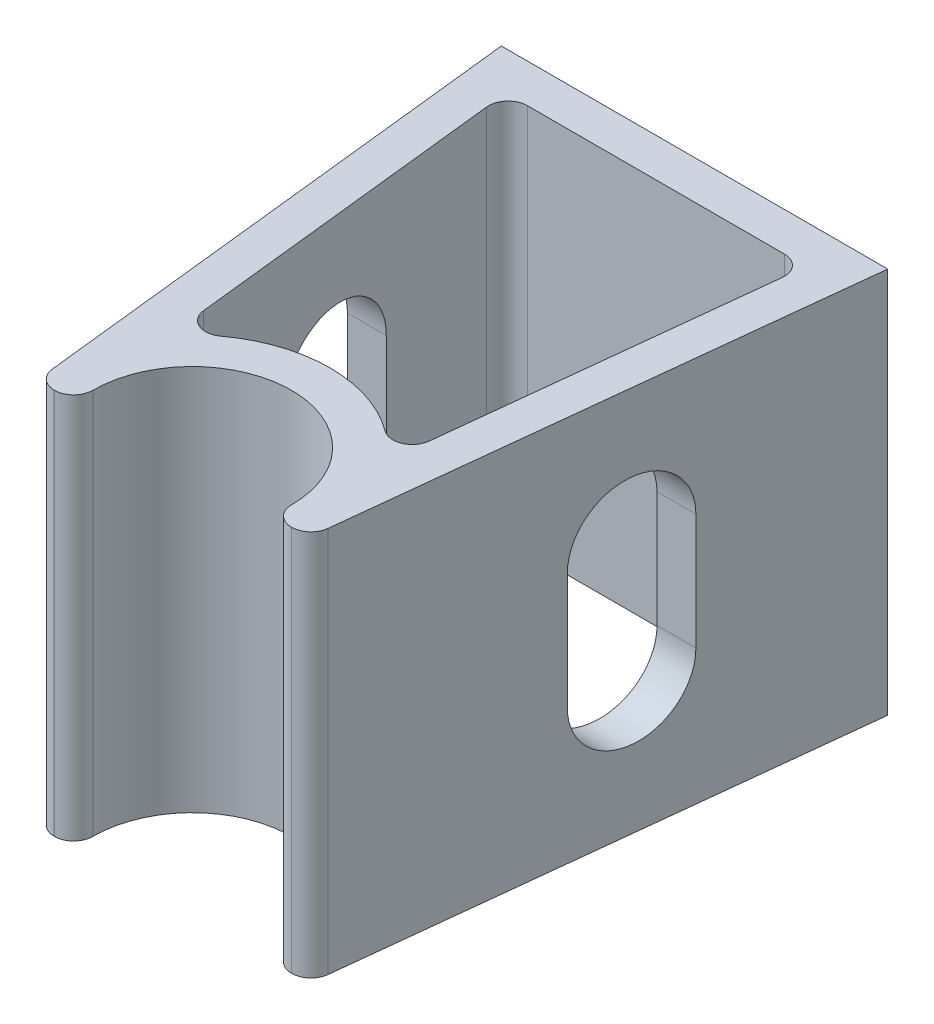
from build123d import *

# Parameters (mm, degrees)
BOSS_EXTRUDE1_DEPTH     = 50
CUT_EXTRUDE1_DEPTH      = 86.732140997
CUT_EXTRUDE1_DEPTH_BACK = 86.732140997
FILLET2_R               = 2.5
CUT_EXTRUDE2_DEPTH      = 86.732140997
CUT_EXTRUDE2_DEPTH_BACK = 86.732140997
SKETCH4_W               = 0.314102564
SKETCH4_H               = 2.557692308
SKETCH4_W_2             = 2.512820513
SKETCH4_H_2             = 0.224358974
BOSS_EXTRUDE2_DEPTH     = 1


with BuildPart() as part:
    # Sketch1 → Boss-Extrude1 (new body)
    with BuildSketch(Plane(origin=(0, 0, 0), x_dir=(1, 0, 0), z_dir=(0, 1, 0))):
        with BuildLine():
            Line((-12.6, -2.5), (-17.6, -2.5))
            Line((-17.6, -2.5), (-25, 65))
            Line((-25, 65), (25, 65))
            Line((25, 65), (17.6, -2.5))
            Line((17.6, -2.5), (12.6, -2.5))
            ThreePointArc((12.6, -2.5), (0, 12.845621822), (-12.6, -2.5))
        make_face()
    extrude(amount=BOSS_EXTRUDE1_DEPTH)

    # Sketch2 → Cut-Extrude1 (cut, two sides: drawn at the far end of the back side and taken through both)
    with BuildSketch(Plane(origin=(0, 50, 0), x_dir=(1, 0, 0), z_dir=(0, 1, 0)).offset(-CUT_EXTRUDE1_DEPTH_BACK)):
        with BuildLine():
            Line((14.050316299, 11.002491996), (19.421894954, 60))
            Line((19.421894954, 60), (-19.421894954, 60))
            Line((-19.421894954, 60), (-14.050316299, 11.002491996))
            ThreePointArc((-14.050316299, 11.002491996), (0, 17.845621822), (14.050316299, 11.002491996))
        make_face()
    extrude(amount=CUT_EXTRUDE1_DEPTH + CUT_EXTRUDE1_DEPTH_BACK, mode=Mode.SUBTRACT)

    # Fillet2
    fillet2_edges = [part.edges().sort_by_distance(p)[0] for p in [
        (-12.6, 25, 2.5),
        (-17.6, 25, 2.5),
        (17.6, 25, 2.5),
        (12.6, 25, 2.5),
        (14.050316299, 25, -11.002491996),
        (-14.050316299, 25, -11.002491996),
        (-19.421894954, 25, -60),
        (19.421894954, 25, -60),
    ]]
    fillet(fillet2_edges, radius=FILLET2_R)

    # Sketch3 → Cut-Extrude2 (cut, two sides: drawn at the far end of the back side and taken through both)
    with BuildSketch(Plane(origin=(0, 0, 0), x_dir=(0, 0, -1), z_dir=(1, 0, 0)).offset(-CUT_EXTRUDE2_DEPTH_BACK)):
        with BuildLine():
            Line((42.627558228, 32.5), (42.627558228, 17.5))
            ThreePointArc((42.627558228, 17.5), (35.127558228, 10), (27.627558228, 17.5))
            Line((27.627558228, 17.5), (27.627558228, 32.5))
            ThreePointArc((27.627558228, 32.5), (35.127558228, 40), (42.627558228, 32.5))
        make_face()
    extrude(amount=CUT_EXTRUDE2_DEPTH + CUT_EXTRUDE2_DEPTH_BACK, mode=Mode.SUBTRACT)

    # Sketch4 → Boss-Extrude2 (add)
    # profile 1 of 12: a face of its own
    with BuildSketch(Plane(origin=(0, 0, -65), x_dir=(-1, 0, 0), z_dir=(0, 0, -1))):
        with BuildLine():
            Line((-14.489153563, 26.614514951), (-14.175050999, 26.614514951))
            Line((-14.175050999, 26.614514951), (-14.175050999, 26.170003733))
            add(Edge.make_bspline(
                [(-14.175050999, 26.170003733), (-14.146767049, 26.208891335), (-14.09257229, 26.283403708), (-14.003706637, 26.381593992), (-13.914930525, 26.464922147), (-13.850997143, 26.508665018), (-13.820283371, 26.529679214)],
                knots=[0, 0, 0, 0, 1.134379233, 2.173579362, 3.122582517, 4, 4, 4, 4], degree=3))
            add(Edge.make_bspline(
                [(-13.820283371, 26.529679214), (-13.778418709, 26.549684579), (-13.695420809, 26.589345793), (-13.564001584, 26.629579351), (-13.429526915, 26.654304453), (-13.338718701, 26.657685826), (-13.293039781, 26.659386746)],
                knots=[0, 0, 0, 0, 1.014936303, 2.012140481, 3.000054389, 4, 4, 4, 4], degree=3))
            add(Edge.make_bspline(
                [(-13.293039781, 26.659386746), (-13.262146785, 26.658341455), (-13.201011206, 26.656272881), (-13.110427116, 26.642812846), (-13.022568504, 26.619546673), (-12.937954474, 26.587139349), (-12.858233795, 26.547892662), (-12.785144597, 26.501842954), (-12.719520389, 26.450145879), (-12.661394338, 26.390466946), (-12.609125313, 26.321130347), (-12.561046466, 26.240266098), (-12.516621254, 26.146058437), (-12.491999945, 26.077691896), (-12.479037377, 26.041698445)],
                knots=[0, 0, 0, 0, 1.009824226, 1.998387844, 2.986035974, 3.974953746, 4.955485308, 5.885931332, 6.793869504, 7.679848016, 8.601185859, 9.625726857, 10.749998409, 12, 12, 12, 12], degree=3))
            add(Edge.make_bspline(
                [(-12.479037377, 26.041698445), (-12.465326126, 26.066422864), (-12.438344309, 26.115077049), (-12.393038672, 26.183935311), (-12.345570875, 26.248342103), (-12.295536382, 26.308348527), (-12.243111796, 26.363658258), (-12.188050395, 26.414454159), (-12.130665614, 26.460954373), (-12.050873374, 26.515277533), (-11.947060767, 26.572978714), (-11.816172652, 26.623007158), (-11.68002248, 26.653923286), (-11.587604782, 26.657553559), (-11.540936416, 26.659386746)],
                knots=[0, 0, 0, 0, 0.86119277, 1.694706429, 2.50939023, 3.298075842, 4.073795165, 4.829715201, 5.57930267, 6.321991688, 7.768977793, 9.186738141, 10.579381044, 12, 12, 12, 12], degree=3))
            add(Edge.make_bspline(
                [(-11.540936416, 26.659386746), (-11.498054953, 26.657769525), (-11.414131767, 26.654604467), (-11.291954501, 26.629750994), (-11.178012696, 26.587073346), (-11.07253562, 26.52883971), (-10.977375806, 26.455660527), (-10.894659497, 26.368591689), (-10.824889134, 26.268249066), (-10.779310494, 26.173857077), (-10.74839523, 26.090521744), (-10.729333996, 26.019515453), (-10.7124943, 25.9413639), (-10.698513055, 25.855973639), (-10.688294503, 25.76304303), (-10.680723788, 25.662724154), (-10.675599714, 25.554939043), (-10.675237642, 25.480573543), (-10.675050999, 25.44223931)],
                knots=[0, 0, 0, 0, 1.209669288, 2.367440248, 3.500751976, 4.631527125, 5.755587489, 6.87532382, 8.007944318, 9.190864318, 9.82315674, 10.514484317, 11.263564316, 12.079023757, 12.955305781, 13.901327259, 14.918167583, 16, 16, 16, 16], degree=3))
            Line((-10.675050999, 25.44223931), (-10.675050999, 24.056822643))
            Line((-10.675050999, 24.056822643), (-10.989153563, 24.056822643))
            Line((-10.989153563, 24.056822643), (-10.989153563, 25.443641554))
            add(Edge.make_bspline(
                [(-10.989153563, 25.443641554), (-10.989231446, 25.476362128), (-10.989381126, 25.539246094), (-10.992074757, 25.629498546), (-10.997150071, 25.711766903), (-11.00308471, 25.785938991), (-11.011328519, 25.85218778), (-11.021974451, 25.910380198), (-11.033252131, 25.960974009), (-11.051988122, 26.017060057), (-11.081936014, 26.078930268), (-11.127553494, 26.145653843), (-11.1850236, 26.203734644), (-11.251383757, 26.25415296), (-11.326932201, 26.295146601), (-11.410196924, 26.324422611), (-11.500660976, 26.34254549), (-11.563283764, 26.344351505), (-11.595623916, 26.345284182)],
                knots=[0, 0, 0, 0, 1.253487763, 2.409012846, 3.458416907, 4.410876679, 5.259312806, 6.014470957, 6.676830364, 7.243083969, 8.276244668, 9.299465089, 10.325150304, 11.392391894, 12.482080715, 13.603491619, 14.762376348, 16, 16, 16, 16], degree=3))
            add(Edge.make_bspline(
                [(-11.595623916, 26.345284182), (-11.63529387, 26.343868024), (-11.713696781, 26.341069159), (-11.828142268, 26.312495286), (-11.938113284, 26.269415035), (-12.040328417, 26.206982578), (-12.134356208, 26.132174214), (-12.215255786, 26.043224619), (-12.282087971, 25.942594692), (-12.327341947, 25.849447989), (-12.355931248, 25.765778546), (-12.374808164, 25.692681174), (-12.389491556, 25.609599606), (-12.403262085, 25.517092115), (-12.412249813, 25.414521935), (-12.420418185, 25.302363534), (-12.424239048, 25.180279574), (-12.424773507, 25.095652886), (-12.425050999, 25.05171447)],
                knots=[0, 0, 0, 0, 1.090531906, 2.155305635, 3.229839962, 4.33261226, 5.44038871, 6.529323825, 7.629011124, 8.757537029, 9.370236727, 10.061839251, 10.834451254, 11.692844982, 12.636905849, 13.66920014, 14.789842145, 16, 16, 16, 16], degree=3))
            Line((-12.425050999, 25.05171447), (-12.425050999, 24.056822643))
            Line((-12.425050999, 24.056822643), (-12.739153563, 24.056822643))
            Line((-12.739153563, 24.056822643), (-12.739153563, 25.357403573))
            add(Edge.make_bspline(
                [(-12.739153563, 25.357403573), (-12.739232994, 25.394096892), (-12.739385812, 25.464691149), (-12.742062129, 25.565924824), (-12.747148751, 25.658005904), (-12.753029299, 25.740827368), (-12.761489477, 25.814238697), (-12.77109924, 25.878633455), (-12.78244785, 25.933850206), (-12.801237735, 25.994413591), (-12.829952203, 26.061134514), (-12.876140465, 26.132275535), (-12.933748045, 26.194543632), (-13.001318921, 26.247702381), (-13.077324603, 26.291643862), (-13.161308004, 26.323303614), (-13.252512917, 26.341727904), (-13.315390623, 26.3440764), (-13.347727281, 26.345284182)],
                knots=[0, 0, 0, 0, 1.320475261, 2.540461679, 3.643808994, 4.639130445, 5.527981419, 6.302341397, 6.981980563, 7.553956391, 8.582137848, 9.585246428, 10.591171744, 11.620968678, 12.668337649, 13.738356861, 14.836885341, 16, 16, 16, 16], degree=3))
            add(Edge.make_bspline(
                [(-13.347727281, 26.345284182), (-13.385743493, 26.343753722), (-13.461508452, 26.340703569), (-13.572810422, 26.313249296), (-13.680296105, 26.270245221), (-13.782250804, 26.210585402), (-13.875924953, 26.136686323), (-13.95793322, 26.049771427), (-14.026875745, 25.950922394), (-14.07260756, 25.858757877), (-14.102106034, 25.777184602), (-14.121701369, 25.707833655), (-14.138540995, 25.630833406), (-14.151055017, 25.545946295), (-14.163135432, 25.453725201), (-14.168965741, 25.353710712), (-14.174637303, 25.245988624), (-14.174909718, 25.171616079), (-14.175050999, 25.133044599)],
                knots=[0, 0, 0, 0, 1.098833095, 2.189935336, 3.297829714, 4.440610912, 5.596351641, 6.740013378, 7.886572111, 9.072425424, 9.705826452, 10.395263256, 11.156850408, 11.985370555, 12.878090359, 13.847760091, 14.883794034, 16, 16, 16, 16], degree=3))
            Line((-14.175050999, 25.133044599), (-14.175050999, 24.056822643))
            Line((-14.175050999, 24.056822643), (-14.489153563, 24.056822643))
            Line((-14.489153563, 24.056822643), (-14.489153563, 26.614514951))
        make_face()
    # profile 2 of 12: a face of its own
    with BuildSketch(Plane(origin=(0, 0, -65), x_dir=(-1, 0, 0), z_dir=(0, 0, -1))):
        with BuildLine():
            Line((-7.354538179, 26.614514951), (-7.354538179, 24.056822643))
            Line((-7.354538179, 24.056822643), (-7.668640743, 24.056822643))
            Line((-7.668640743, 24.056822643), (-7.668640743, 24.499230496))
            add(Edge.make_bspline(
                [(-7.668640743, 24.499230496), (-7.704059533, 24.459190902), (-7.773179749, 24.381053131), (-7.888620867, 24.278970958), (-8.010989045, 24.194592637), (-8.139690366, 24.126442721), (-8.274608609, 24.075250665), (-8.415444696, 24.038864506), (-8.562256077, 24.015470671), (-8.662508432, 24.013134649), (-8.713312217, 24.011950849)],
                knots=[0, 0, 0, 0, 1.074387032, 2.096679803, 3.090159297, 4.057316773, 5.018401886, 5.985159533, 6.978961417, 8, 8, 8, 8], degree=3))
            add(Edge.make_bspline(
                [(-8.713312217, 24.011950849), (-8.758480171, 24.013177221), (-8.847553376, 24.015595681), (-8.978582453, 24.034357985), (-9.104674703, 24.064488606), (-9.225949275, 24.106389496), (-9.341621421, 24.161970318), (-9.452681517, 24.228511566), (-9.558554209, 24.307752396), (-9.657625748, 24.398340424), (-9.748857749, 24.496735411), (-9.828919021, 24.601680958), (-9.895672101, 24.712723262), (-9.951492182, 24.828456416), (-9.994488526, 24.949771335), (-10.024462161, 25.076248503), (-10.043202607, 25.207738377), (-10.045620068, 25.2972779), (-10.046845871, 25.342680015)],
                knots=[0, 0, 0, 0, 1.033919861, 2.038935746, 3.024066025, 3.998881131, 4.97069526, 5.957263378, 6.95902576, 7.993208707, 9.027059324, 10.027763471, 11.009749337, 11.988697705, 12.965288445, 13.950418724, 14.960734635, 16, 16, 16, 16], degree=3))
            add(Edge.make_bspline(
                [(-10.046845871, 25.342680015), (-10.0455929, 25.387143719), (-10.043115843, 25.475046062), (-10.024662623, 25.60432476), (-9.993631614, 25.728843021), (-9.950083767, 25.848199964), (-9.894241812, 25.962540014), (-9.826313725, 26.071944039), (-9.7462946, 26.176713437), (-9.654042193, 26.274384663), (-9.554107423, 26.364605278), (-9.447198692, 26.443014323), (-9.335975411, 26.510731172), (-9.2187124, 26.564384648), (-9.097145295, 26.607793753), (-8.970191849, 26.637826721), (-8.838380271, 26.655524042), (-8.748889779, 26.658086806), (-8.703496512, 26.659386746)],
                knots=[0, 0, 0, 0, 1.020392517, 2.01726096, 2.990465484, 3.961182959, 4.928053699, 5.906110375, 6.912531644, 7.948652711, 8.985773172, 9.998621852, 10.987621588, 11.969261332, 12.953316658, 13.946091881, 14.958173133, 16, 16, 16, 16], degree=3))
            add(Edge.make_bspline(
                [(-8.703496512, 26.659386746), (-8.651296653, 26.657948994), (-8.548935193, 26.655129632), (-8.399207184, 26.631666904), (-8.257562706, 26.592028437), (-8.122908354, 26.538110939), (-7.995727668, 26.46646221), (-7.877224683, 26.376082249), (-7.7661592, 26.267541062), (-7.701778908, 26.184170617), (-7.668640743, 26.14125774)],
                knots=[0, 0, 0, 0, 1.038897134, 2.037228247, 3.008116434, 3.962042015, 4.918381754, 5.904844433, 6.921570401, 8, 8, 8, 8], degree=3))
            Line((-7.668640743, 26.14125774), (-7.668640743, 26.614514951))
            Line((-7.668640743, 26.614514951), (-7.354538179, 26.614514951))
        make_face()
        with BuildLine():
            add(Edge.make_bspline(
                [(-8.699289781, 26.345284182), (-8.745204119, 26.343650544), (-8.835831719, 26.340426003), (-8.968875721, 26.315252508), (-9.096189135, 26.273367914), (-9.21713521, 26.216086012), (-9.329803426, 26.144057276), (-9.430497097, 26.056935892), (-9.520039798, 25.957098878), (-9.595348063, 25.844996768), (-9.65673856, 25.724818677), (-9.699905591, 25.599194239), (-9.728374839, 25.470389261), (-9.731283359, 25.383026575), (-9.732743307, 25.339174406)],
                knots=[0, 0, 0, 0, 1.031046209, 2.035121221, 3.029706178, 4.034933723, 5.034054252, 6.02443088, 7.017295772, 8.038157696, 9.050218397, 10.03989886, 11.016116709, 12, 12, 12, 12], degree=3))
            add(Edge.make_bspline(
                [(-9.732743307, 25.339174406), (-9.730878414, 25.295584299), (-9.727155937, 25.208574943), (-9.700405242, 25.079594366), (-9.655525369, 24.953940324), (-9.594283306, 24.832679331), (-9.517596681, 24.72009523), (-9.428708029, 24.618355108), (-9.326757748, 24.53086552), (-9.213830241, 24.457627946), (-9.09322227, 24.398465425), (-8.966388339, 24.357299786), (-8.835712701, 24.330722005), (-8.746860367, 24.327617528), (-8.702094268, 24.326053413)],
                knots=[0, 0, 0, 0, 0.979072187, 1.954306742, 2.945804271, 3.96968567, 4.997920485, 5.998718438, 6.996577872, 8.005894225, 9.015743152, 10.005417472, 10.995077863, 12, 12, 12, 12], degree=3))
            add(Edge.make_bspline(
                [(-8.702094268, 24.326053413), (-8.656647766, 24.327713377), (-8.566259179, 24.33101488), (-8.432820471, 24.356296145), (-8.303325509, 24.398064944), (-8.17953828, 24.455964071), (-8.064222149, 24.527721426), (-7.960724271, 24.611728517), (-7.873208303, 24.709431702), (-7.799015693, 24.816808155), (-7.740840277, 24.934520151), (-7.698464218, 25.059854342), (-7.673410312, 25.19281509), (-7.670252582, 25.283679017), (-7.668640743, 25.330059823)],
                knots=[0, 0, 0, 0, 1.01762866, 2.023962475, 3.030623092, 4.058876274, 5.077231937, 6.066672613, 7.034107872, 8.005628644, 8.981990164, 9.965428785, 10.961468474, 12, 12, 12, 12], degree=3))
            add(Edge.make_bspline(
                [(-7.668640743, 25.330059823), (-7.669600399, 25.365397653), (-7.671489307, 25.434953687), (-7.685919876, 25.537081204), (-7.708874803, 25.63481493), (-7.741220973, 25.728257619), (-7.783712257, 25.816892635), (-7.834960023, 25.901356395), (-7.895865473, 25.981209606), (-7.965448169, 26.055352677), (-8.041613371, 26.12297914), (-8.122207912, 26.18334338), (-8.208186659, 26.232932153), (-8.298103696, 26.273973425), (-8.39211503, 26.306632574), (-8.49098565, 26.328420268), (-8.593664637, 26.343380589), (-8.663710692, 26.34464297), (-8.699289781, 26.345284182)],
                knots=[0, 0, 0, 0, 1.050140795, 2.067009409, 3.05949893, 4.030605086, 5.00011959, 5.97591094, 6.962425594, 7.979863591, 8.993523472, 9.986985069, 10.967611495, 11.937549037, 12.921786183, 13.919465291, 14.943216303, 16, 16, 16, 16], degree=3))
        make_face(mode=Mode.SUBTRACT)
    # profile 3 of 12: a face of its own
    with BuildSketch(Plane(origin=(0, 0, -65), x_dir=(-1, 0, 0), z_dir=(0, 0, -1))):
        with BuildLine():
            add(Edge.make_bspline(
                [(-6.525812217, 27.691438028), (-6.506320901, 27.690533876), (-6.468153162, 27.688763372), (-6.412959894, 27.673601894), (-6.362702882, 27.647902209), (-6.318125149, 27.613422528), (-6.279873262, 27.572873085), (-6.253092552, 27.525612116), (-6.235880156, 27.474553478), (-6.2338016, 27.438938388), (-6.232743307, 27.420805015)],
                knots=[0, 0, 0, 0, 1.055194115, 2.066272739, 3.074728998, 4.095836921, 5.109056067, 6.073838105, 7.019297344, 8, 8, 8, 8], degree=3))
            add(Edge.make_bspline(
                [(-6.232743307, 27.420805015), (-6.233825467, 27.403142362), (-6.235964769, 27.368225387), (-6.253079257, 27.318051915), (-6.280101495, 27.271447631), (-6.31810062, 27.230976921), (-6.362709381, 27.196516301), (-6.412958167, 27.170811562), (-6.468153616, 27.155651425), (-6.506321055, 27.153880736), (-6.525812217, 27.15297649)],
                knots=[0, 0, 0, 0, 0.96129708, 1.900370562, 2.859976407, 3.87933698, 4.906634145, 5.921202961, 6.938410037, 8, 8, 8, 8], degree=3))
            add(Edge.make_bspline(
                [(-6.525812217, 27.15297649), (-6.545080492, 27.15384621), (-6.582583673, 27.155539007), (-6.636950515, 27.171109024), (-6.686779004, 27.196525097), (-6.731443677, 27.230751282), (-6.76867387, 27.27169618), (-6.795772195, 27.318023474), (-6.812847157, 27.368232628), (-6.814991786, 27.403144794), (-6.81607664, 27.420805015)],
                knots=[0, 0, 0, 0, 1.054934014, 2.053291228, 3.073705704, 4.106921865, 5.123545215, 6.088680038, 7.033164197, 8, 8, 8, 8], degree=3))
            add(Edge.make_bspline(
                [(-6.81607664, 27.420805015), (-6.815015554, 27.438935865), (-6.812931513, 27.474545997), (-6.795759396, 27.52564103), (-6.768899589, 27.572622532), (-6.731419025, 27.613648032), (-6.686785565, 27.647893466), (-6.63694882, 27.673304448), (-6.58258412, 27.688875787), (-6.545080644, 27.690568402), (-6.525812217, 27.691438028)],
                knots=[0, 0, 0, 0, 0.98631895, 1.937192651, 2.907499808, 3.917963147, 4.944918757, 5.95915025, 6.951458133, 8, 8, 8, 8], degree=3))
        make_face()
    # profile 4 of 12: a face of its own
    with BuildSketch(Plane(origin=(0, 0, -65), x_dir=(-1, 0, 0), z_dir=(0, 0, -1))):
        with Locations((-6.524409974, 25.335668797)):
            Rectangle(SKETCH4_W, SKETCH4_H)
    # profile 5 of 12: a face of its own
    with BuildSketch(Plane(origin=(0, 0, -65), x_dir=(-1, 0, 0), z_dir=(0, 0, -1))):
        with BuildLine():
            Line((-5.604538179, 26.614514951), (-5.290435615, 26.614514951))
            Line((-5.290435615, 26.614514951), (-5.290435615, 26.15317681))
            add(Edge.make_bspline(
                [(-5.290435615, 26.15317681), (-5.25689798, 26.195019533), (-5.191817028, 26.276216796), (-5.083432695, 26.382937371), (-4.968888795, 26.470882596), (-4.848886791, 26.54098639), (-4.723263781, 26.593833016), (-4.592785511, 26.631998947), (-4.456670805, 26.654883776), (-4.364106368, 26.657874006), (-4.317278563, 26.659386746)],
                knots=[0, 0, 0, 0, 1.12780773, 2.188550248, 3.19190651, 4.159438251, 5.104880172, 6.052711206, 7.014878035, 8, 8, 8, 8], degree=3))
            add(Edge.make_bspline(
                [(-4.317278563, 26.659386746), (-4.269947929, 26.657641551), (-4.177310461, 26.654225782), (-4.0424324, 26.627209091), (-3.916459006, 26.581063836), (-3.799839451, 26.517851765), (-3.694712237, 26.439245292), (-3.602387386, 26.34766751), (-3.526024138, 26.242331427), (-3.474826775, 26.144608271), (-3.441101128, 26.057919477), (-3.41986879, 25.983672726), (-3.401837809, 25.900954575), (-3.386206061, 25.810014986), (-3.375628949, 25.710216796), (-3.367286657, 25.601969104), (-3.361307963, 25.485306973), (-3.361070756, 25.404620346), (-3.360948435, 25.363012547)],
                knots=[0, 0, 0, 0, 1.235846778, 2.418850247, 3.575807741, 4.728682307, 5.871620074, 6.994088408, 8.11269785, 9.256955736, 9.865816715, 10.540099792, 11.271859618, 12.076849838, 12.949306005, 13.892391288, 14.913166135, 16, 16, 16, 16], degree=3))
            Line((-3.360948435, 25.363012547), (-3.360948435, 24.056822643))
            Line((-3.360948435, 24.056822643), (-3.675050999, 24.056822643))
            Line((-3.675050999, 24.056822643), (-3.675050999, 25.259947643))
            add(Edge.make_bspline(
                [(-3.675050999, 25.259947643), (-3.675244207, 25.294770088), (-3.675613781, 25.361379499), (-3.676779428, 25.456748522), (-3.679589235, 25.543235101), (-3.683537548, 25.620632468), (-3.689316578, 25.688866305), (-3.695339209, 25.748075581), (-3.702704186, 25.798185124), (-3.709267099, 25.828350206), (-3.712210454, 25.841878733)],
                knots=[0, 0, 0, 0, 1.430800155, 2.736877192, 3.918605307, 4.986035426, 5.920637409, 6.731861385, 7.431261377, 8, 8, 8, 8], degree=3))
            add(Edge.make_bspline(
                [(-3.712210454, 25.841878733), (-3.722835986, 25.881589918), (-3.743286847, 25.958021663), (-3.79382083, 26.061696015), (-3.85763501, 26.149894203), (-3.93553286, 26.222070925), (-4.026761935, 26.278241761), (-4.131069078, 26.317215716), (-4.247447719, 26.341591985), (-4.329302102, 26.344019117), (-4.371966063, 26.345284182)],
                knots=[0, 0, 0, 0, 1.084156227, 2.086665306, 3.027808233, 3.945421172, 4.874247719, 5.839848303, 6.874090471, 8, 8, 8, 8], degree=3))
            add(Edge.make_bspline(
                [(-4.371966063, 26.345284182), (-4.397233747, 26.344808177), (-4.44723784, 26.343866176), (-4.521387812, 26.334414878), (-4.593311985, 26.318956423), (-4.663732194, 26.298087785), (-4.731239988, 26.269425516), (-4.798004279, 26.236896146), (-4.861511043, 26.196347934), (-4.92311444, 26.151157312), (-4.980427248, 26.101078105), (-5.033755586, 26.048233595), (-5.081293607, 25.991957991), (-5.124362282, 25.933158044), (-5.161540545, 25.871026206), (-5.193993633, 25.806161899), (-5.221529328, 25.73847975), (-5.235212021, 25.691504689), (-5.242058211, 25.668000528)],
                knots=[0, 0, 0, 0, 1.023777757, 2.026029729, 3.023749952, 4.003683103, 4.997618607, 5.993177895, 7.010360494, 8.046726602, 9.087585522, 10.09234134, 11.086953743, 12.070360549, 13.043493632, 14.017870808, 15.008233677, 16, 16, 16, 16], degree=3))
            add(Edge.make_bspline(
                [(-5.242058211, 25.668000528), (-5.245997859, 25.650745325), (-5.254574268, 25.613181651), (-5.263837448, 25.551537231), (-5.272245023, 25.480227256), (-5.279281982, 25.399334939), (-5.283587399, 25.308577064), (-5.288281795, 25.208341226), (-5.289990856, 25.098227738), (-5.29028321, 25.021566045), (-5.290435615, 24.981602291)],
                knots=[0, 0, 0, 0, 0.615963638, 1.340920617, 2.168419149, 3.115676021, 4.16674242, 5.331190069, 6.6087489, 8, 8, 8, 8], degree=3))
            Line((-5.290435615, 24.981602291), (-5.290435615, 24.056822643))
            Line((-5.290435615, 24.056822643), (-5.604538179, 24.056822643))
            Line((-5.604538179, 24.056822643), (-5.604538179, 26.614514951))
        make_face()
    # profile 6 of 12: a face of its own
    with BuildSketch(Plane(origin=(0, 0, -65), x_dir=(-1, 0, 0), z_dir=(0, 0, -1))):
        with Locations((-1.790435615, 23.585668797)):
            Rectangle(SKETCH4_W_2, SKETCH4_H_2)
    # profile 7 of 12: a face of its own
    with BuildSketch(Plane(origin=(0, 0, -65), x_dir=(-1, 0, 0), z_dir=(0, 0, -1))):
        with BuildLine():
            Line((-0.219922794, 24.056822643), (-0.219922794, 27.646566233))
            Line((-0.219922794, 27.646566233), (0.09417977, 27.646566233))
            Line((0.09417977, 27.646566233), (0.09417977, 26.150372323))
            add(Edge.make_bspline(
                [(0.09417977, 26.150372323), (0.129573189, 26.191130255), (0.198627208, 26.27065066), (0.31440366, 26.37449831), (0.435809229, 26.462550787), (0.563767485, 26.535136906), (0.698460418, 26.590410513), (0.839192527, 26.630832903), (0.986323568, 26.655219806), (1.086642742, 26.657985879), (1.137449001, 26.659386746)],
                knots=[0, 0, 0, 0, 1.077089805, 2.101446609, 3.097517232, 4.067117542, 5.031729543, 5.997785507, 6.985986182, 8, 8, 8, 8], degree=3))
            add(Edge.make_bspline(
                [(1.137449001, 26.659386746), (1.182615139, 26.658146518), (1.27191629, 26.655694375), (1.403198438, 26.63705988), (1.529511713, 26.606842078), (1.650787361, 26.564949899), (1.766459493, 26.509366921), (1.87751855, 26.442825614), (1.983395535, 26.363587284), (2.08245042, 26.272988974), (2.173744306, 26.174632351), (2.253656817, 26.069452036), (2.321156513, 25.958976945), (2.376987805, 25.843576883), (2.420158858, 25.722780532), (2.449901125, 25.596706333), (2.46879459, 25.465478315), (2.471174836, 25.376165511), (2.472384898, 25.330760945)],
                knots=[0, 0, 0, 0, 1.034377878, 2.045141349, 3.03070803, 4.00595497, 4.978199603, 5.965204761, 6.967410914, 8.002051993, 9.036360596, 10.037508045, 11.022711142, 11.997267194, 12.969246472, 13.954813154, 14.960274251, 16, 16, 16, 16], degree=3))
            add(Edge.make_bspline(
                [(2.472384898, 25.330760945), (2.471148458, 25.286060927), (2.468710392, 25.197919532), (2.450089084, 25.068212975), (2.419342819, 24.943374276), (2.375381636, 24.823726019), (2.320116697, 24.708706106), (2.251005421, 24.599625702), (2.171194422, 24.494586726), (2.078863273, 24.396963094), (1.97894972, 24.306729694), (1.872035477, 24.228323829), (1.760813556, 24.160606709), (1.643550444, 24.106951262), (1.521982402, 24.06355034), (1.394807015, 24.033432649), (1.262743787, 24.015859594), (1.173024899, 24.013264027), (1.127633296, 24.011950849)],
                knots=[0, 0, 0, 0, 1.024244038, 2.01964794, 2.996620209, 3.965911562, 4.936179293, 5.91563013, 6.920572822, 7.955171681, 8.990768464, 10.002129126, 10.989675881, 11.969873457, 12.952483066, 13.943799762, 14.959703725, 16, 16, 16, 16], degree=3))
            add(Edge.make_bspline(
                [(1.127633296, 24.011950849), (1.075668183, 24.013391457), (0.973773659, 24.016216238), (0.824720994, 24.039635218), (0.683639444, 24.079496828), (0.548921896, 24.133058583), (0.422494173, 24.205587238), (0.30355359, 24.295543988), (0.192850218, 24.404411124), (0.127633402, 24.487472614), (0.09417977, 24.530079855)],
                knots=[0, 0, 0, 0, 1.035807596, 2.031038093, 2.998900396, 3.954262848, 4.914341711, 5.895762244, 6.92060972, 8, 8, 8, 8], degree=3))
            Line((0.09417977, 24.530079855), (0.09417977, 24.056822643))
            Line((0.09417977, 24.056822643), (-0.219922794, 24.056822643))
        make_face()
        with BuildLine():
            add(Edge.make_bspline(
                [(1.124828808, 24.326053413), (1.170743161, 24.327687042), (1.26137079, 24.330911565), (1.39441458, 24.356085188), (1.52172879, 24.397969302), (1.642671872, 24.45525301), (1.755351184, 24.527275045), (1.856003818, 24.614421216), (1.945483527, 24.71392273), (2.020135303, 24.826156424), (2.082461548, 24.945607393), (2.125274824, 25.071261694), (2.153994545, 25.199756483), (2.156846844, 25.286902528), (2.158282334, 25.330760945)],
                knots=[0, 0, 0, 0, 1.031910345, 2.036826888, 3.032245421, 4.038315463, 5.03827337, 6.029480047, 7.023177075, 8.037597977, 9.052889626, 10.043399556, 11.015292101, 12, 12, 12, 12], degree=3))
            add(Edge.make_bspline(
                [(2.158282334, 25.330760945), (2.15639459, 25.374576487), (2.152626639, 25.462032647), (2.126251856, 25.591682315), (2.080194066, 25.717269939), (2.019076043, 25.838447928), (1.943208058, 25.951455728), (1.854202094, 26.052945855), (1.752320288, 26.14050584), (1.639496869, 26.213495911), (1.519316678, 26.273055464), (1.392826044, 26.313900489), (1.262667922, 26.340638677), (1.174272429, 26.343727805), (1.129736661, 26.345284182)],
                knots=[0, 0, 0, 0, 0.984795267, 1.965658976, 2.959410029, 3.983795688, 5.009594896, 6.01088574, 7.009236619, 8.019050059, 9.024672985, 10.014834719, 10.999826153, 12, 12, 12, 12], degree=3))
            add(Edge.make_bspline(
                [(1.129736661, 26.345284182), (1.084269154, 26.343728684), (0.994025377, 26.340641338), (0.860857155, 26.313853514), (0.730793871, 26.272805902), (0.606506339, 26.213874553), (0.490652284, 26.141763092), (0.387039671, 26.057022893), (0.297708114, 25.960242985), (0.224164343, 25.851737183), (0.165759544, 25.734552147), (0.123975796, 25.609539944), (0.098976149, 25.477358632), (0.095798017, 25.386725426), (0.09417977, 25.34057665)],
                knots=[0, 0, 0, 0, 1.016820015, 2.018181405, 3.029022337, 4.06341356, 5.088169224, 6.076823655, 7.05054209, 8.02560866, 9.001194327, 9.972267242, 10.967515442, 12, 12, 12, 12], degree=3))
            add(Edge.make_bspline(
                [(0.09417977, 25.34057665), (0.09513944, 25.305238831), (0.097028375, 25.235682822), (0.111458744, 25.133555131), (0.134414406, 25.035822039), (0.1667579, 24.942377043), (0.209259135, 24.853750604), (0.2604694, 24.769254524), (0.321421047, 24.689651245), (0.390327636, 24.615135925), (0.466290017, 24.547326511), (0.547813135, 24.488548286), (0.633231066, 24.437934096), (0.723521037, 24.397589253), (0.817632328, 24.364662732), (0.916530669, 24.342928987), (1.019202093, 24.327953948), (1.08924919, 24.326693595), (1.124828808, 24.326053413)],
                knots=[0, 0, 0, 0, 1.050331198, 2.067384183, 3.060053655, 4.031335885, 5.001026174, 5.976994447, 6.963687968, 7.976578778, 8.990422448, 9.985569286, 10.960374351, 11.936812464, 12.921228065, 13.919088064, 14.943024695, 16, 16, 16, 16], degree=3))
        make_face(mode=Mode.SUBTRACT)
    # profile 8 of 12: a face of its own
    with BuildSketch(Plane(origin=(0, 0, -65), x_dir=(-1, 0, 0), z_dir=(0, 0, -1))):
        with BuildLine():
            Line((3.010846437, 26.614514951), (3.324949001, 26.614514951))
            Line((3.324949001, 26.614514951), (3.324949001, 26.238012547))
            add(Edge.make_bspline(
                [(3.324949001, 26.238012547), (3.348137759, 26.273068376), (3.39248608, 26.340112375), (3.46619901, 26.428781676), (3.541702341, 26.502196722), (3.619357528, 26.560700241), (3.699735628, 26.60451336), (3.78107258, 26.636606395), (3.86464805, 26.65558371), (3.920809974, 26.658117369), (3.948947398, 26.659386746)],
                knots=[0, 0, 0, 0, 1.2804753, 2.448899062, 3.506932113, 4.484331642, 5.4025378, 6.288909075, 7.142734305, 8, 8, 8, 8], degree=3))
            add(Edge.make_bspline(
                [(3.948947398, 26.659386746), (3.970773725, 26.658196219), (4.01568281, 26.655746634), (4.0836654, 26.638535809), (4.153708852, 26.611057786), (4.198851239, 26.585217564), (4.222384898, 26.571746522)],
                knots=[0, 0, 0, 0, 0.901110191, 1.854092781, 2.881294221, 4, 4, 4, 4], degree=3))
            Line((4.222384898, 26.571746522), (4.049908937, 26.299711265))
            add(Edge.make_bspline(
                [(4.049908937, 26.299711265), (4.034799915, 26.306451531), (4.006120101, 26.319245847), (3.964165535, 26.334387857), (3.925484198, 26.343303773), (3.90084064, 26.34465449), (3.889352046, 26.345284182)],
                knots=[0, 0, 0, 0, 1.180555205, 2.24091978, 3.179933427, 4, 4, 4, 4], degree=3))
            add(Edge.make_bspline(
                [(3.889352046, 26.345284182), (3.864146312, 26.343604144), (3.812733922, 26.340177355), (3.737249423, 26.313238547), (3.664002217, 26.269713307), (3.605830555, 26.221442196), (3.560788302, 26.174894398), (3.528648076, 26.134245995), (3.49916533, 26.088667364), (3.470995109, 26.03893768), (3.445328815, 25.984207834), (3.421374146, 25.925024621), (3.399715283, 25.861319492), (3.387365039, 25.816936972), (3.381038744, 25.794202451)],
                knots=[0, 0, 0, 0, 1.125678352, 2.296057538, 3.5422874, 4.923748041, 5.663163013, 6.437101912, 7.23742474, 8.08941207, 8.991984279, 9.93940061, 10.944477711, 12, 12, 12, 12], degree=3))
            add(Edge.make_bspline(
                [(3.381038744, 25.794202451), (3.376306351, 25.773925278), (3.365824459, 25.729012879), (3.355632921, 25.653664354), (3.345563403, 25.564640695), (3.338466785, 25.461694102), (3.331888743, 25.345081659), (3.328178661, 25.214625713), (3.32507552, 25.070192362), (3.324992453, 24.969218009), (3.324949001, 24.916397964)],
                knots=[0, 0, 0, 0, 0.566838948, 1.255505196, 2.06880316, 3.007127437, 4.065329342, 5.249902469, 6.561414163, 8, 8, 8, 8], degree=3))
            Line((3.324949001, 24.916397964), (3.324949001, 24.056822643))
            Line((3.324949001, 24.056822643), (3.010846437, 24.056822643))
            Line((3.010846437, 24.056822643), (3.010846437, 26.614514951))
        make_face()
    # profile 9 of 12: a face of its own
    with BuildSketch(Plane(origin=(0, 0, -65), x_dir=(-1, 0, 0), z_dir=(0, 0, -1))):
        with BuildLine():
            Line((7.139051565, 26.614514951), (7.139051565, 24.056822643))
            Line((7.139051565, 24.056822643), (6.824949001, 24.056822643))
            Line((6.824949001, 24.056822643), (6.824949001, 24.499230496))
            add(Edge.make_bspline(
                [(6.824949001, 24.499230496), (6.78953021, 24.459190902), (6.720409995, 24.381053131), (6.604968877, 24.278970958), (6.482600699, 24.194592637), (6.353899378, 24.126442721), (6.218981134, 24.075250665), (6.078145047, 24.038864506), (5.931333666, 24.015470671), (5.831081312, 24.013134649), (5.780277526, 24.011950849)],
                knots=[0, 0, 0, 0, 1.074387032, 2.096679803, 3.090159297, 4.057316773, 5.018401886, 5.985159533, 6.978961417, 8, 8, 8, 8], degree=3))
            add(Edge.make_bspline(
                [(5.780277526, 24.011950849), (5.735109573, 24.013177221), (5.646036368, 24.015595681), (5.515007291, 24.034357985), (5.388915041, 24.064488606), (5.267640468, 24.106389496), (5.151968323, 24.161970318), (5.040908226, 24.228511566), (4.935035534, 24.307752396), (4.835963995, 24.398340424), (4.744731995, 24.496735411), (4.664670722, 24.601680958), (4.597917642, 24.712723262), (4.542097562, 24.828456416), (4.499101217, 24.949771335), (4.469127583, 25.076248503), (4.450387136, 25.207738377), (4.447969676, 25.2972779), (4.446743873, 25.342680015)],
                knots=[0, 0, 0, 0, 1.033919861, 2.038935746, 3.024066025, 3.998881131, 4.97069526, 5.957263378, 6.95902576, 7.993208707, 9.027059324, 10.027763471, 11.009749337, 11.988697705, 12.965288445, 13.950418724, 14.960734635, 16, 16, 16, 16], degree=3))
            add(Edge.make_bspline(
                [(4.446743873, 25.342680015), (4.447996844, 25.387143719), (4.450473901, 25.475046062), (4.468927121, 25.60432476), (4.499958129, 25.728843021), (4.543505977, 25.848199964), (4.599347932, 25.962540014), (4.667276019, 26.071944039), (4.747295144, 26.176713437), (4.839547551, 26.274384663), (4.939482321, 26.364605278), (5.046391052, 26.443014323), (5.157614333, 26.510731172), (5.274877344, 26.564384648), (5.396444448, 26.607793753), (5.523397894, 26.637826721), (5.655209473, 26.655524042), (5.744699965, 26.658086806), (5.790093232, 26.659386746)],
                knots=[0, 0, 0, 0, 1.020392517, 2.01726096, 2.990465484, 3.961182959, 4.928053699, 5.906110375, 6.912531644, 7.948652711, 8.985773172, 9.998621852, 10.987621588, 11.969261332, 12.953316658, 13.946091881, 14.958173133, 16, 16, 16, 16], degree=3))
            add(Edge.make_bspline(
                [(5.790093232, 26.659386746), (5.842293091, 26.657948994), (5.944654551, 26.655129632), (6.09438256, 26.631666904), (6.236027038, 26.592028437), (6.37068139, 26.538110939), (6.497862076, 26.46646221), (6.61636506, 26.376082249), (6.727430543, 26.267541062), (6.791810835, 26.184170617), (6.824949001, 26.14125774)],
                knots=[0, 0, 0, 0, 1.038897134, 2.037228247, 3.008116434, 3.962042015, 4.918381754, 5.904844433, 6.921570401, 8, 8, 8, 8], degree=3))
            Line((6.824949001, 26.14125774), (6.824949001, 26.614514951))
            Line((6.824949001, 26.614514951), (7.139051565, 26.614514951))
        make_face()
        with BuildLine():
            add(Edge.make_bspline(
                [(5.794299962, 26.345284182), (5.748385624, 26.343650544), (5.657758024, 26.340426003), (5.524714022, 26.315252508), (5.397400608, 26.273367914), (5.276454534, 26.216086012), (5.163786317, 26.144057276), (5.063092647, 26.056935892), (4.973549945, 25.957098878), (4.898241681, 25.844996768), (4.836851184, 25.724818677), (4.793684152, 25.599194239), (4.765214905, 25.470389261), (4.762306384, 25.383026575), (4.760846437, 25.339174406)],
                knots=[0, 0, 0, 0, 1.031046209, 2.035121221, 3.029706178, 4.034933723, 5.034054252, 6.02443088, 7.017295772, 8.038157696, 9.050218397, 10.03989886, 11.016116709, 12, 12, 12, 12], degree=3))
            add(Edge.make_bspline(
                [(4.760846437, 25.339174406), (4.76271133, 25.295584299), (4.766433807, 25.208574943), (4.793184501, 25.079594366), (4.838064375, 24.953940324), (4.899306437, 24.832679331), (4.975993062, 24.72009523), (5.064881715, 24.618355108), (5.166831996, 24.53086552), (5.279759503, 24.457627946), (5.400367473, 24.398465425), (5.527201405, 24.357299786), (5.657877043, 24.330722005), (5.746729377, 24.327617528), (5.791495475, 24.326053413)],
                knots=[0, 0, 0, 0, 0.979072187, 1.954306742, 2.945804271, 3.96968567, 4.997920485, 5.998718438, 6.996577872, 8.005894225, 9.015743152, 10.005417472, 10.995077863, 12, 12, 12, 12], degree=3))
            add(Edge.make_bspline(
                [(5.791495475, 24.326053413), (5.836941978, 24.327713377), (5.927330564, 24.33101488), (6.060769272, 24.356296145), (6.190264235, 24.398064944), (6.314051463, 24.455964071), (6.429367595, 24.527721426), (6.532865472, 24.611728517), (6.620381441, 24.709431702), (6.69457405, 24.816808155), (6.752749467, 24.934520151), (6.795125526, 25.059854342), (6.820179432, 25.19281509), (6.823337161, 25.283679017), (6.824949001, 25.330059823)],
                knots=[0, 0, 0, 0, 1.01762866, 2.023962475, 3.030623092, 4.058876274, 5.077231937, 6.066672613, 7.034107872, 8.005628644, 8.981990164, 9.965428785, 10.961468474, 12, 12, 12, 12], degree=3))
            add(Edge.make_bspline(
                [(6.824949001, 25.330059823), (6.823989344, 25.365397653), (6.822100437, 25.434953687), (6.807669867, 25.537081204), (6.784714941, 25.63481493), (6.752368771, 25.728257619), (6.709877487, 25.816892635), (6.658629721, 25.901356395), (6.597724271, 25.981209606), (6.528141575, 26.055352677), (6.451976372, 26.12297914), (6.371381832, 26.18334338), (6.285403085, 26.232932153), (6.195486048, 26.273973425), (6.101474713, 26.306632574), (6.002604094, 26.328420268), (5.899925107, 26.343380589), (5.829879051, 26.34464297), (5.794299962, 26.345284182)],
                knots=[0, 0, 0, 0, 1.050140795, 2.067009409, 3.05949893, 4.030605086, 5.00011959, 5.97591094, 6.962425594, 7.979863591, 8.993523472, 9.986985069, 10.967611495, 11.937549037, 12.921786183, 13.919465291, 14.943216303, 16, 16, 16, 16], degree=3))
        make_face(mode=Mode.SUBTRACT)
    # profile 10 of 12: a face of its own
    with BuildSketch(Plane(origin=(0, 0, -65), x_dir=(-1, 0, 0), z_dir=(0, 0, -1))):
        with BuildLine():
            Line((7.857000283, 26.614514951), (8.171102847, 26.614514951))
            Line((8.171102847, 26.614514951), (8.171102847, 26.15317681))
            add(Edge.make_bspline(
                [(8.171102847, 26.15317681), (8.204640482, 26.195019533), (8.269721433, 26.276216796), (8.378105766, 26.382937371), (8.492649667, 26.470882596), (8.61265167, 26.54098639), (8.73827468, 26.593833016), (8.86875295, 26.631998947), (9.004867656, 26.654883776), (9.097432093, 26.657874006), (9.144259898, 26.659386746)],
                knots=[0, 0, 0, 0, 1.12780773, 2.188550248, 3.19190651, 4.159438251, 5.104880172, 6.052711206, 7.014878035, 8, 8, 8, 8], degree=3))
            add(Edge.make_bspline(
                [(9.144259898, 26.659386746), (9.191590532, 26.657641551), (9.284228, 26.654225782), (9.419106061, 26.627209091), (9.545079455, 26.581063836), (9.661699011, 26.517851765), (9.766826224, 26.439245292), (9.859151076, 26.34766751), (9.935514323, 26.242331427), (9.986711686, 26.144608271), (10.020437334, 26.057919477), (10.041669671, 25.983672726), (10.059700653, 25.900954575), (10.075332401, 25.810014986), (10.085909513, 25.710216796), (10.094251804, 25.601969104), (10.100230499, 25.485306973), (10.100467705, 25.404620346), (10.100590026, 25.363012547)],
                knots=[0, 0, 0, 0, 1.235846778, 2.418850247, 3.575807741, 4.728682307, 5.871620074, 6.994088408, 8.11269785, 9.256955736, 9.865816715, 10.540099792, 11.271859618, 12.076849838, 12.949306005, 13.892391288, 14.913166135, 16, 16, 16, 16], degree=3))
            Line((10.100590026, 25.363012547), (10.100590026, 24.056822643))
            Line((10.100590026, 24.056822643), (9.786487462, 24.056822643))
            Line((9.786487462, 24.056822643), (9.786487462, 25.259947643))
            add(Edge.make_bspline(
                [(9.786487462, 25.259947643), (9.786294254, 25.294770088), (9.78592468, 25.361379499), (9.784759034, 25.456748522), (9.781949227, 25.543235101), (9.778000914, 25.620632468), (9.772221883, 25.688866305), (9.766199252, 25.748075581), (9.758834275, 25.798185124), (9.752271362, 25.828350206), (9.749328007, 25.841878733)],
                knots=[0, 0, 0, 0, 1.430800155, 2.736877192, 3.918605307, 4.986035426, 5.920637409, 6.731861385, 7.431261377, 8, 8, 8, 8], degree=3))
            add(Edge.make_bspline(
                [(9.749328007, 25.841878733), (9.738702476, 25.881589918), (9.718251615, 25.958021663), (9.667717632, 26.061696015), (9.603903451, 26.149894203), (9.526005602, 26.222070925), (9.434776526, 26.278241761), (9.330469383, 26.317215716), (9.214090743, 26.341591985), (9.13223636, 26.344019117), (9.089572398, 26.345284182)],
                knots=[0, 0, 0, 0, 1.084156227, 2.086665306, 3.027808233, 3.945421172, 4.874247719, 5.839848303, 6.874090471, 8, 8, 8, 8], degree=3))
            add(Edge.make_bspline(
                [(9.089572398, 26.345284182), (9.064304715, 26.344808177), (9.014300622, 26.343866176), (8.94015065, 26.334414878), (8.868226476, 26.318956423), (8.797806267, 26.298087785), (8.730298474, 26.269425516), (8.663534183, 26.236896146), (8.600027418, 26.196347934), (8.538424021, 26.151157312), (8.481111214, 26.101078105), (8.427782875, 26.048233595), (8.380244855, 25.991957991), (8.33717618, 25.933158044), (8.299997916, 25.871026206), (8.267544828, 25.806161899), (8.240009133, 25.73847975), (8.226326441, 25.691504689), (8.219480251, 25.668000528)],
                knots=[0, 0, 0, 0, 1.023777757, 2.026029729, 3.023749952, 4.003683103, 4.997618607, 5.993177895, 7.010360494, 8.046726602, 9.087585522, 10.09234134, 11.086953743, 12.070360549, 13.043493632, 14.017870808, 15.008233677, 16, 16, 16, 16], degree=3))
            add(Edge.make_bspline(
                [(8.219480251, 25.668000528), (8.215540602, 25.650745325), (8.206964193, 25.613181651), (8.197701013, 25.551537231), (8.189293438, 25.480227256), (8.182256479, 25.399334939), (8.177951063, 25.308577064), (8.173256666, 25.208341226), (8.171547605, 25.098227738), (8.171255251, 25.021566045), (8.171102847, 24.981602291)],
                knots=[0, 0, 0, 0, 0.615963638, 1.340920617, 2.168419149, 3.115676021, 4.16674242, 5.331190069, 6.6087489, 8, 8, 8, 8], degree=3))
            Line((8.171102847, 24.981602291), (8.171102847, 24.056822643))
            Line((8.171102847, 24.056822643), (7.857000283, 24.056822643))
            Line((7.857000283, 24.056822643), (7.857000283, 26.614514951))
        make_face()
    # profile 11 of 12: a face of its own
    with BuildSketch(Plane(origin=(0, 0, -65), x_dir=(-1, 0, 0), z_dir=(0, 0, -1))):
        with BuildLine():
            Line((13.331359257, 26.059927611), (13.068438584, 25.896566233))
            add(Edge.make_bspline(
                [(13.068438584, 25.896566233), (13.039608719, 25.932394627), (12.982862023, 26.002916737), (12.884322787, 26.093926671), (12.779311373, 26.172093712), (12.666033325, 26.235797463), (12.544647525, 26.285018914), (12.415632674, 26.319849119), (12.279007169, 26.341553362), (12.18534197, 26.344020199), (12.13734884, 26.345284182)],
                knots=[0, 0, 0, 0, 1.026593902, 2.0206758, 2.988051866, 3.946915611, 4.916868779, 5.907761954, 6.927957743, 8, 8, 8, 8], degree=3))
            add(Edge.make_bspline(
                [(12.13734884, 26.345284182), (12.098989884, 26.34422734), (12.023442961, 26.342145918), (11.912536807, 26.329135424), (11.806894454, 26.305493416), (11.705853745, 26.274342459), (11.610133327, 26.232592169), (11.519482408, 26.181782413), (11.433096918, 26.122732373), (11.353480177, 26.054321828), (11.28065117, 25.97992316), (11.217552256, 25.900169465), (11.162615323, 25.817449573), (11.119509366, 25.729697831), (11.084234196, 25.638921778), (11.061027476, 25.543407922), (11.04556278, 25.444379915), (11.043793452, 25.376861575), (11.042897719, 25.342680015)],
                knots=[0, 0, 0, 0, 1.112346261, 2.190735716, 3.231507886, 4.247384806, 5.251966152, 6.253067467, 7.256802811, 8.280671706, 9.291813951, 10.270744147, 11.225547591, 12.165006084, 13.100104208, 14.043489273, 15.009504848, 16, 16, 16, 16], degree=3))
            add(Edge.make_bspline(
                [(11.042897719, 25.342680015), (11.044676971, 25.297910804), (11.048211501, 25.208975608), (11.075912961, 25.077697507), (11.121257368, 24.950773816), (11.183315219, 24.829105679), (11.261792354, 24.716511524), (11.353964917, 24.615528069), (11.459884, 24.528112041), (11.578616331, 24.455639516), (11.707374074, 24.397378149), (11.844764179, 24.355870816), (11.989663959, 24.330818443), (12.088870707, 24.3276625), (12.139452206, 24.326053413)],
                knots=[0, 0, 0, 0, 0.966302908, 1.919585723, 2.883856336, 3.870342332, 4.860282998, 5.839159637, 6.814385684, 7.815993281, 8.834850808, 9.858348828, 10.908058873, 12, 12, 12, 12], degree=3))
            add(Edge.make_bspline(
                [(12.139452206, 24.326053413), (12.18580739, 24.32735291), (12.276907629, 24.329906767), (12.410074914, 24.35143573), (12.536854825, 24.386679364), (12.657242855, 24.435827014), (12.771019021, 24.49935453), (12.877448196, 24.5777137), (12.978648134, 24.668650301), (13.038145111, 24.738968272), (13.068438584, 24.774771361)],
                knots=[0, 0, 0, 0, 1.039848629, 2.043578496, 3.018386758, 3.987534228, 4.954977003, 5.934852016, 6.948509513, 8, 8, 8, 8], degree=3))
            Line((13.068438584, 24.774771361), (13.331359257, 24.6022954))
            add(Edge.make_bspline(
                [(13.331359257, 24.6022954), (13.315771555, 24.579404673), (13.284647888, 24.533699196), (13.232620263, 24.46925508), (13.176500431, 24.408933397), (13.116507334, 24.352815007), (13.053424324, 24.299556988), (12.985096415, 24.251705413), (12.913726803, 24.206570591), (12.838477645, 24.165957719), (12.760126947, 24.129451397), (12.678784958, 24.098060226), (12.594805145, 24.07109012), (12.508088769, 24.049652774), (12.418464871, 24.032541935), (12.326165236, 24.021188234), (12.231221655, 24.012712952), (12.167049503, 24.012207086), (12.134544353, 24.011950849)],
                knots=[0, 0, 0, 0, 0.954134338, 1.905101784, 2.851144739, 3.791306361, 4.734911809, 5.6936923, 6.663572882, 7.643865596, 8.638447847, 9.640600242, 10.646758161, 11.676244097, 12.717260333, 13.78922464, 14.880174919, 16, 16, 16, 16], degree=3))
            add(Edge.make_bspline(
                [(12.134544353, 24.011950849), (12.08493347, 24.012842128), (11.987695778, 24.014589043), (11.84537327, 24.033797519), (11.709359603, 24.062755135), (11.579701245, 24.104318869), (11.45637801, 24.157823644), (11.339504892, 24.223180559), (11.229468874, 24.300932349), (11.127358091, 24.389695118), (11.033576645, 24.485935759), (10.953050455, 24.589785677), (10.883205184, 24.697426725), (10.827117641, 24.811236251), (10.782470715, 24.929701623), (10.751965882, 25.053771863), (10.732236144, 25.182424117), (10.729952765, 25.270156999), (10.728795155, 25.314635143)],
                knots=[0, 0, 0, 0, 1.1129367, 2.181364009, 3.217532258, 4.231199276, 5.232079859, 6.230262199, 7.231623845, 8.250719726, 9.263571943, 10.242672461, 11.195837495, 12.138959767, 13.085126421, 14.0317438, 15.002148558, 16, 16, 16, 16], degree=3))
            add(Edge.make_bspline(
                [(10.728795155, 25.314635143), (10.729236171, 25.344813578), (10.730113425, 25.404843465), (10.740175352, 25.493938532), (10.753173825, 25.581847077), (10.775199562, 25.667454797), (10.800640194, 25.752060087), (10.833115726, 25.834643188), (10.871211121, 25.915587861), (10.914463068, 25.99468559), (10.963151813, 26.07063513), (11.017033046, 26.142388795), (11.074077383, 26.21080856), (11.136953495, 26.273532321), (11.202993148, 26.333068512), (11.274064724, 26.387826636), (11.349760576, 26.437967627), (11.428943898, 26.484418643), (11.51156861, 26.525778078), (11.59713528, 26.561411316), (11.685128309, 26.591863892), (11.775688454, 26.615972811), (11.868214627, 26.636190234), (11.963435965, 26.648908081), (12.060988187, 26.657894353), (12.12704421, 26.658885146), (12.16048586, 26.659386746)],
                knots=[0, 0, 0, 0, 0.990994727, 1.971252077, 2.943264845, 3.907940874, 4.872158414, 5.844625996, 6.82015047, 7.809835459, 8.804511986, 9.781214284, 10.756496977, 11.728388426, 12.696359165, 13.676225489, 14.672885716, 15.677705647, 16.690706858, 17.706033469, 18.721040654, 19.747369689, 20.783475414, 21.830280724, 22.901553713, 24, 24, 24, 24], degree=3))
            add(Edge.make_bspline(
                [(12.16048586, 26.659386746), (12.202365968, 26.658464855), (12.285916847, 26.656625681), (12.409857554, 26.641147029), (12.531972748, 26.617810612), (12.650119851, 26.583237782), (12.762866366, 26.541374127), (12.868401816, 26.494361412), (12.96424192, 26.439766809), (13.052169509, 26.380046694), (13.132349026, 26.312685789), (13.205603519, 26.236878831), (13.273435168, 26.153020352), (13.31189188, 26.091214621), (13.331359257, 26.059927611)],
                knots=[0, 0, 0, 0, 1.095225653, 2.184976855, 3.262915854, 4.344593502, 5.400796181, 6.407717688, 7.363229445, 8.282371371, 9.184954523, 10.097238608, 11.036792983, 12, 12, 12, 12], degree=3))
        make_face()
    # profile 12 of 12: a face of its own
    with BuildSketch(Plane(origin=(0, 0, -65), x_dir=(-1, 0, 0), z_dir=(0, 0, -1))):
        with BuildLine():
            Line((13.959564385, 27.646566233), (14.273666949, 27.646566233))
            Line((14.273666949, 27.646566233), (14.273666949, 26.131442034))
            add(Edge.make_bspline(
                [(14.273666949, 26.131442034), (14.307384251, 26.173586017), (14.373033565, 26.255642509), (14.483529682, 26.3627037), (14.597000554, 26.455502321), (14.717365364, 26.529372778), (14.842415884, 26.587729322), (14.972679528, 26.629116968), (15.1081805, 26.654568065), (15.20020565, 26.657766483), (15.246824001, 26.659386746)],
                knots=[0, 0, 0, 0, 1.125788106, 2.19196713, 3.20547328, 4.180437432, 5.132270164, 6.079753143, 7.027236121, 8, 8, 8, 8], degree=3))
            add(Edge.make_bspline(
                [(15.246824001, 26.659386746), (15.294154394, 26.657641316), (15.386791389, 26.654225088), (15.521672852, 26.627211707), (15.647633727, 26.581054269), (15.764299569, 26.517887243), (15.869124267, 26.439214416), (15.961974031, 26.348382894), (16.03781483, 26.243108975), (16.089413947, 26.145852721), (16.122987354, 26.059313968), (16.144239181, 25.985077455), (16.162258379, 25.902355542), (16.177958115, 25.81119081), (16.188421696, 25.711145638), (16.196826314, 25.602671384), (16.202802769, 25.485774266), (16.203034373, 25.404854016), (16.203154129, 25.363012547)],
                knots=[0, 0, 0, 0, 1.235656852, 2.418478516, 3.575258207, 4.727955599, 5.870717718, 6.98870536, 8.107142894, 9.245821548, 9.854588956, 10.528768408, 11.260415777, 12.065282286, 12.943670737, 13.886611085, 14.907229059, 16, 16, 16, 16], degree=3))
            Line((16.203154129, 25.363012547), (16.203154129, 24.056822643))
            Line((16.203154129, 24.056822643), (15.889051565, 24.056822643))
            Line((15.889051565, 24.056822643), (15.889051565, 25.259947643))
            add(Edge.make_bspline(
                [(15.889051565, 25.259947643), (15.888861262, 25.294770313), (15.888497244, 25.361380153), (15.8872939, 25.456746262), (15.884607684, 25.543242396), (15.880266858, 25.620591348), (15.875701551, 25.688900951), (15.869418234, 25.748072006), (15.862108, 25.798185781), (15.855539218, 25.82835041), (15.852593232, 25.841878733)],
                knots=[0, 0, 0, 0, 1.430932559, 2.737130458, 3.918967929, 4.986496826, 5.920444988, 6.731744033, 7.431208747, 8, 8, 8, 8], degree=3))
            add(Edge.make_bspline(
                [(15.852593232, 25.841878733), (15.841168986, 25.881572997), (15.819205942, 25.957884987), (15.768157965, 26.061547398), (15.704398954, 26.149932138), (15.626551692, 26.221846426), (15.535993328, 26.278257966), (15.432133364, 26.317325748), (15.315949295, 26.34157347), (15.234097824, 26.344012773), (15.191435379, 26.345284182)],
                knots=[0, 0, 0, 0, 1.090059168, 2.095632401, 3.037101401, 3.955032261, 4.878929692, 5.839099886, 6.873700383, 8, 8, 8, 8], degree=3))
            add(Edge.make_bspline(
                [(15.191435379, 26.345284182), (15.166167606, 26.344808356), (15.116163336, 26.343866708), (15.04201467, 26.334412809), (14.970085606, 26.31896409), (14.899683428, 26.298059552), (14.832300231, 26.269614015), (14.765971906, 26.236683826), (14.702577697, 26.196375571), (14.64099188, 26.151149803), (14.583674346, 26.101080044), (14.530347231, 26.048233089), (14.482808891, 25.991958125), (14.4397403, 25.933158008), (14.402562014, 25.871026215), (14.370108932, 25.806161897), (14.342573236, 25.738479751), (14.328890543, 25.691504689), (14.322044353, 25.668000528)],
                knots=[0, 0, 0, 0, 1.024319606, 2.027102035, 3.025350316, 4.005802111, 5.00026367, 5.987881639, 7.005602596, 8.042517216, 9.083927026, 10.089214625, 11.084353441, 12.06828073, 13.041928858, 14.016821737, 15.00770877, 16, 16, 16, 16], degree=3))
            add(Edge.make_bspline(
                [(14.322044353, 25.668000528), (14.318104926, 25.650979577), (14.309520429, 25.61388883), (14.300205596, 25.552714506), (14.291867799, 25.481628134), (14.28481925, 25.400737534), (14.280496163, 25.309746292), (14.275837922, 25.209275332), (14.274103908, 25.098695312), (14.273816956, 25.021799804), (14.273666949, 24.981602291)],
                knots=[0, 0, 0, 0, 0.607992626, 1.324890765, 2.152360218, 3.099583803, 4.150613268, 5.323148443, 6.60066238, 8, 8, 8, 8], degree=3))
            Line((14.273666949, 24.981602291), (14.273666949, 24.056822643))
            Line((14.273666949, 24.056822643), (13.959564385, 24.056822643))
            Line((13.959564385, 24.056822643), (13.959564385, 27.646566233))
        make_face()
    extrude(amount=BOSS_EXTRUDE2_DEPTH)


solid = part.part
